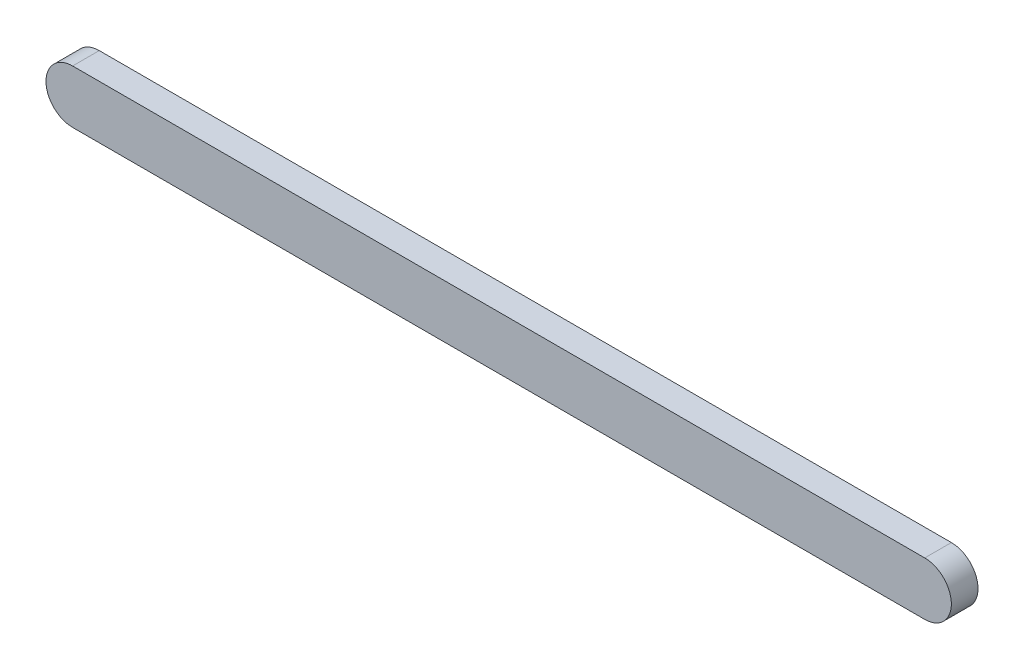
from build123d import *

# Parameters (mm, degrees)
BOSS_EXTRUDE1_DEPTH = 2.5


with BuildPart() as part:
    # Sketch1 → Boss-Extrude1 (new body)
    with BuildSketch(Plane.XY):
        with BuildLine():
            Line((-53.333333333, -0.166666667), (26.666666667, -0.166666667))
            ThreePointArc((26.666666667, -0.166666667), (29.166666667, -2.666666667), (26.666666667, -5.166666667))
            Line((26.666666667, -5.166666667), (-53.333333333, -5.166666667))
            ThreePointArc((-53.333333333, -5.166666667), (-55.833333333, -2.666666667), (-53.333333333, -0.166666667))
        make_face()
    extrude(amount=BOSS_EXTRUDE1_DEPTH)


solid = part.part
